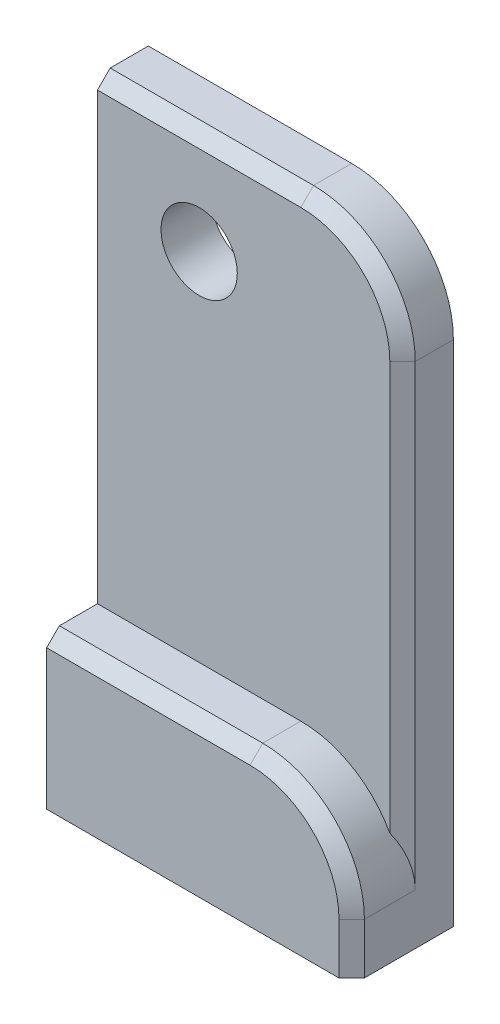
from build123d import *

# Parameters (mm, degrees)
SKETCH1_W           = 76.2
SKETCH1_H           = 152.4
BOSS_EXTRUDE1_DEPTH = 12.7
SKETCH2_W           = 76.2
SKETCH2_H           = 38.1
BOSS_EXTRUDE2_DEPTH = 12.7
SKETCH3_R           = 9.525
CUT_EXTRUDE1_DEPTH  = 171.861025398
FILLET1_R           = 25.4
CHAMFER1_SIZE       = 3.175
SHELL1_T            = -2.54


with BuildPart() as part:
    # Sketch1 → Boss-Extrude1 (new body)
    with BuildSketch(Plane.XY):
        with Locations((38.1, 76.2)):
            Rectangle(SKETCH1_W, SKETCH1_H)
    extrude(amount=BOSS_EXTRUDE1_DEPTH)

    # Sketch2 → Boss-Extrude2 (add)
    with BuildSketch(Plane.XY.offset(12.7)):
        with Locations((38.1, 19.05)):
            Rectangle(SKETCH2_W, SKETCH2_H)
    extrude(amount=BOSS_EXTRUDE2_DEPTH)

    # Sketch3 → Cut-Extrude1 (cut, through all)
    with BuildSketch(Plane.XY.offset(12.7)):
        with Locations((25.4, 127)):
            Circle(SKETCH3_R)
    extrude(amount=-CUT_EXTRUDE1_DEPTH, mode=Mode.SUBTRACT)

    # Fillet1
    fillet1_edges = [part.edges().sort_by_distance(p)[0] for p in [
        (76.2, 38.1, 19.05),
        (76.2, 152.4, 6.35),
    ]]
    fillet(fillet1_edges, radius=FILLET1_R)

    # Chamfer1
    chamfer1_edges = [part.edges().sort_by_distance(p)[0] for p in [
        (76.2, 69.85, 12.7),
        (76.2, 6.35, 25.4),
        (25.4, 38.1, 25.4),
        (68.760512242, 30.660512242, 25.4),
        (68.760512242, 144.960512242, 12.7),
        (25.4, 152.4, 12.7),
    ]]
    chamfer(chamfer1_edges, length=CHAMFER1_SIZE)

    # Shell1
    shell1_openings = [part.faces().sort_by_distance(p)[0] for p in [
        (38.022271753, 74.033331384, 0),
        (0, 64.646896792, 8.851917713),
        (38.003285466, 0, 12.669604003),
    ]]
    offset(amount=SHELL1_T, openings=shell1_openings, kind=Kind.INTERSECTION)


solid = part.part
